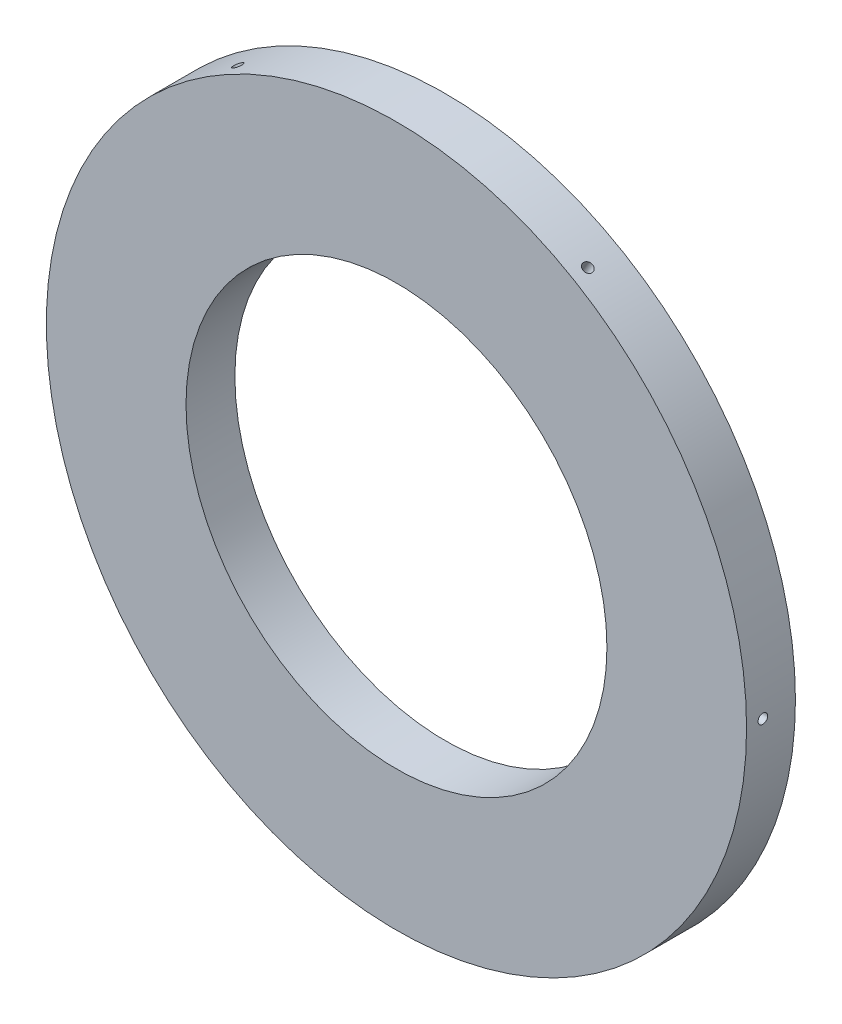
from build123d import *

# Parameters (mm, degrees)
SKETCH1_R                = 81.8896
SKETCH1_R_2              = 49.225199999999994
BOSS_EXTRUDE1_DEPTH      = 11.43
CIRPATTERN1_COUNT        = 6
CUT_EXTRUDE1_DEPTH       = 10.921999999999999
FILLET2_R                = 4.9276
FILLET4_R                = 6.35
FILLET3_R                = 1.5875
CIRPATTERN2_COUNT        = 6
FILLET2_OF_CIRPATTERN2_R = 4.9276
FILLET4_OF_CIRPATTERN2_R = 6.35
FILLET3_OF_CIRPATTERN2_R = 1.5875


with BuildPart() as part:
    # Sketch1 → Boss-Extrude1 (new body)
    with BuildSketch(Plane.XY):
        Circle(SKETCH1_R)
        Circle(SKETCH1_R_2, mode=Mode.SUBTRACT)
    extrude(amount=BOSS_EXTRUDE1_DEPTH)

    # Sketch2 → #4-40 Tapped Hole1 (revolve, cut)
    with BuildSketch(Plane(origin=(81.8896, 0, 7.62), x_dir=(0, 0, -1), z_dir=(-1.2e-16, 1, 0))):
        Polygon((0, 0), (-2.03e-15, 8.273752757686852), (1.130299999999998, 7.594599999999999), (1.130299999999999, -1e-17), align=None)
    f_4_40_tapped_hole1 = revolve(axis=Axis((88.2396, 7.8e-16, 7.62), (-1, -1.2e-16, 0)), mode=Mode.SUBTRACT)

    # CirPattern1: #4-40 Tapped Hole1 ×6 about axis
    cirpattern1_axis = Axis((0, 0, 11.43), (0, 0, -1))
    for i in range(1, CIRPATTERN1_COUNT):
        add(f_4_40_tapped_hole1.rotate(cirpattern1_axis, i * 360 / CIRPATTERN1_COUNT), mode=Mode.SUBTRACT)

    # Sketch3 → Cut-Extrude1 (cut)
    with BuildSketch(Plane.XY):
        with BuildLine():
            ThreePointArc((27.78089806339295, 42.682326925688685), (44.10407573853007, 25.463500000000053), (50.85442844197543, 2.7178))
            Line((50.85442844197543, 2.7178), (81.08206364492705, 2.7178))
            ThreePointArc((81.08206364492705, 2.7177999999999995), (70.25856254806233, 40.56380000000017), (42.894715664868535, 68.86022690777371))
            Line((42.8947156648687, 68.86022690777364), (27.780898063392954, 42.682326925688685))
        make_face()
    cut_extrude1 = extrude(amount=CUT_EXTRUDE1_DEPTH, mode=Mode.SUBTRACT)

    # Fillet2
    fillet2_edges = [part.edges().sort_by_distance(p)[0] for p in [
        (81.08206364492705, 2.7177999999999995, 5.460999999999999),
        (42.89471566486861, 68.86022690777367, 5.460999999999999),
    ]]
    fillet(fillet2_edges, radius=FILLET2_R)

    # Fillet4
    fillet4_edges = [part.edges().sort_by_distance(p)[0] for p in [
        (50.85442844197543, 2.717800000000004, 5.460999999999999),
        (27.780898063392954, 42.682326925688685, 5.460999999999999),
    ]]
    fillet(fillet4_edges, radius=FILLET4_R)

    # Fillet3
    fillet3_edges = [part.edges().sort_by_distance(p)[0] for p in [
        (70.25856254806236, 40.56380000000009, 10.921999999999999),
        (79.47044523612693, 4.340477622942812, 10.921999999999999),
        (43.49418650408965, 66.65318561307464, 10.921999999999999),
        (35.44622060929171, 55.95905503158863, 10.921999999999999),
        (44.10407573853008, 25.463500000000057, 10.921999999999999),
        (66.18507353377304, 2.7178, 10.921999999999999),
        (52.435265307332486, 4.235298019863146, 10.921999999999999),
        (29.885508331465545, 43.292622800395286, 10.921999999999999),
    ]]
    fillet(fillet3_edges, radius=FILLET3_R)

    # CirPattern2: Cut-Extrude1 ×6 about axis
    cirpattern2_axis = Axis((2.201e-14, -3.67e-14, 0), (0, 0, 1))
    for i in range(1, CIRPATTERN2_COUNT):
        add(cut_extrude1.rotate(cirpattern2_axis, i * 360 / CIRPATTERN2_COUNT), mode=Mode.SUBTRACT)

    # Fillet2 of CirPattern2
    fillet2_of_cirpattern2_edges = [part.edges().sort_by_distance(p)[0] for p in [
        (38.18734798005816, 71.57802690777346, 5.460999999999999),
        (-38.18734798005847, 71.57802690777332, 5.460999999999999),
        (-42.89471566486885, 68.86022690777342, 5.460999999999999),
        (-81.08206364492706, 2.7177999999996385, 5.460999999999999),
        (-81.082063644927, -2.717800000000063, 5.460999999999999),
        (-42.89471566486858, -68.86022690777374, 5.460999999999999),
        (-38.18734798005815, -71.57802690777352, 5.460999999999999),
        (38.18734798005848, -71.57802690777342, 5.460999999999999),
        (42.89471566486892, -68.8602269077735, 5.460999999999999),
        (81.0820636449271, -2.7177999999996834, 5.460999999999999),
    ]]
    fillet(fillet2_of_cirpattern2_edges, radius=FILLET2_OF_CIRPATTERN2_R)

    # Fillet4 of CirPattern2
    fillet4_of_cirpattern2_edges = [part.edges().sort_by_distance(p)[0] for p in [
        (23.07353037858235, 45.40012692568858, 5.460999999999999),
        (-23.0735303785825, 45.40012692568852, 5.460999999999999),
        (-27.780898063393053, 42.68232692568854, 5.460999999999999),
        (-50.854428441975436, 2.717799999999809, 5.460999999999999),
        (-50.85442844197539, -2.717800000000071, 5.460999999999999),
        (-27.780898063392915, -42.682326925688756, 5.460999999999999),
        (-23.073530378582323, -45.40012692568864, 5.460999999999999),
        (23.073530378582525, -45.4001269256886, 5.460999999999999),
        (27.780898063393114, -42.682326925688606, 5.460999999999999),
        (50.854428441975486, -2.7177999999998645, 5.460999999999999),
    ]]
    fillet(fillet4_of_cirpattern2_edges, radius=FILLET4_OF_CIRPATTERN2_R)

    # Fillet3 of CirPattern2
    fillet3_of_cirpattern2_edges = [part.edges().sort_by_distance(p)[0] for p in [
        (-1.2736e-13, 81.12759999999994, 10.921999999999999),
        (35.97625873203708, 70.99366323601731, 10.921999999999999),
        (-35.976258732037294, 70.9936632360172, 10.921999999999999),
        (-30.73885292448133, 58.676855031588424, 10.921999999999999),
        (-8.118e-14, 50.92699999999997, 10.921999999999999),
        (30.738852924481158, 58.67685503158852, 10.921999999999999),
        (22.549756975866813, 47.52792082025832, 10.921999999999999),
        (-22.549756975866966, 47.52792082025827, 10.921999999999999),
        (-70.25856254806246, 40.56379999999984, 10.921999999999999),
        (-43.494186504089825, 66.65318561307447, 10.921999999999999),
        (-79.47044523612692, 4.340477622942541, 10.921999999999999),
        (-66.18507353377302, 2.717799999999763, 10.921999999999999),
        (-44.10407573853013, 25.463499999999883, 10.921999999999999),
        (-35.44622060929185, 55.95905503158849, 10.921999999999999),
        (-29.885508331465648, 43.29262280039514, 10.921999999999999),
        (-52.43526530733249, 4.23529801986295, 10.921999999999999),
        (-70.25856254806232, -40.56380000000016, 10.921999999999999),
        (-79.47044523612689, -4.340477622942876, 10.921999999999999),
        (-43.49418650408961, -66.65318561307471, 10.921999999999999),
        (-35.44622060929167, -55.9590550315887, 10.921999999999999),
        (-44.104075738530035, -25.463500000000124, 10.921999999999999),
        (-66.185073533773, -2.7178000000000653, 10.921999999999999),
        (-52.43526530733244, -4.2352980198632135, 10.921999999999999),
        (-29.885508331465505, -43.29262280039535, 10.921999999999999),
        (1.3586e-13, -81.12760000000003, 10.921999999999999),
        (-35.976258732037074, -70.99366323601737, 10.921999999999999),
        (35.97625873203731, -70.9936632360173, 10.921999999999999),
        (30.738852924481353, -58.67685503158851, 10.921999999999999),
        (1.0033e-13, -50.92700000000004, 10.921999999999999),
        (-30.738852924481137, -58.67685503158857, 10.921999999999999),
        (-22.549756975866792, -47.52792082025838, 10.921999999999999),
        (22.54975697586699, -47.52792082025834, 10.921999999999999),
        (70.25856254806253, -40.56379999999989, 10.921999999999999),
        (43.49418650408989, -66.65318561307454, 10.921999999999999),
        (79.47044523612696, -4.340477622942585, 10.921999999999999),
        (66.18507353377306, -2.717799999999815, 10.921999999999999),
        (44.104075738530184, -25.46349999999994, 10.921999999999999),
        (35.44622060929191, -55.959055031588555, 10.921999999999999),
        (29.885508331465708, -43.29262280039521, 10.921999999999999),
        (52.43526530733254, -4.235298019863005, 10.921999999999999),
    ]]
    fillet(fillet3_of_cirpattern2_edges, radius=FILLET3_OF_CIRPATTERN2_R)


solid = part.part
